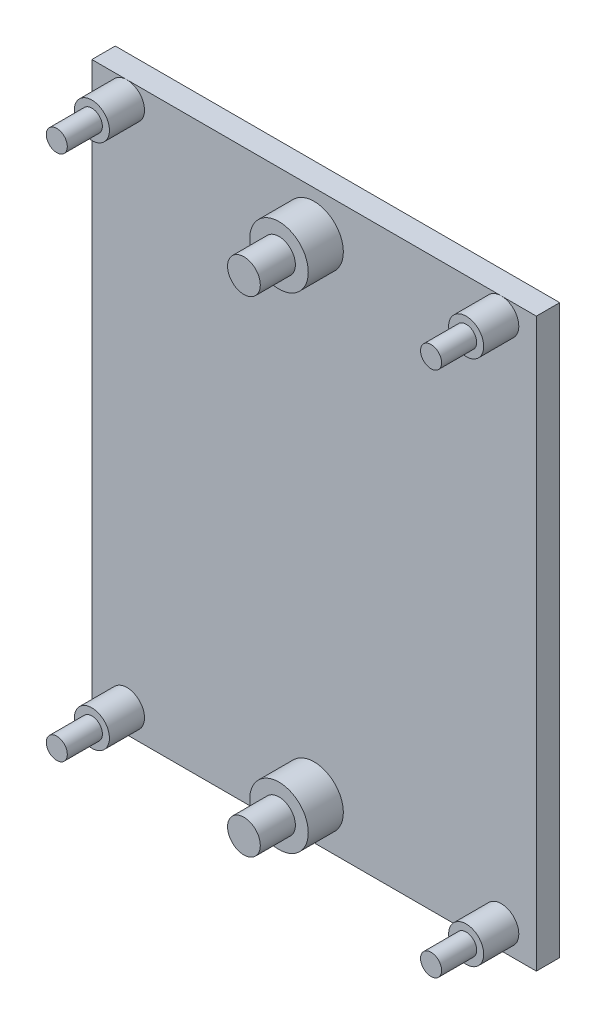
from build123d import *

# Parameters (mm, degrees)
SKIZZE1_W                       = 48.5
SKIZZE1_H                       = 38
AUFSATZ_LINEAR_AUSTRAGEN1_DEPTH = 2
SKIZZE2_R                       = 1.5
SKIZZE2_R_2                     = 2.5
AUFSATZ_LINEAR_AUSTRAGEN2_DEPTH = 3
SKIZZE3_R                       = 1.4
SKIZZE3_R_2                     = 0.9
AUFSATZ_LINEAR_AUSTRAGEN3_DEPTH = 3


with BuildPart() as part:
    # Skizze1 → Aufsatz-Linear austragen1 (new body)
    with BuildSketch(Plane(origin=(0, 0, 0), x_dir=(0, 1, 0), z_dir=(0, 0, 1))):
        Rectangle(SKIZZE1_W, SKIZZE1_H)
    extrude(amount=AUFSATZ_LINEAR_AUSTRAGEN1_DEPTH)

    # Skizze2 → Aufsatz-Linear austragen2 (add)
    with BuildSketch(Plane.XY.offset(2)):
        with Locations((-16, -22.25)):
            Circle(SKIZZE2_R)
        with Locations((16, -22.25)):
            Circle(SKIZZE2_R)
        with Locations(Location((16, 22.75, 0), (0, 0, 90))):
            Circle(SKIZZE2_R)
        with Locations(Location((-16, 22.75, 0), (0, 0, 90))):
            Circle(SKIZZE2_R)
        with Locations((0, 20.75)):
            Circle(SKIZZE2_R_2)
        with Locations((0, -20.75)):
            Circle(SKIZZE2_R_2)
    extrude(amount=AUFSATZ_LINEAR_AUSTRAGEN2_DEPTH)

    # Skizze3 → Aufsatz-Linear austragen3 (add)
    with BuildSketch(Plane.XY.offset(5)):
        with Locations((0, 20.75)):
            Circle(SKIZZE3_R)
        with Locations((16, 22.75)):
            Circle(SKIZZE3_R_2)
        with Locations((-16, 22.75)):
            Circle(SKIZZE3_R_2)
        with Locations((0, -20.75)):
            Circle(SKIZZE3_R)
        with Locations((-16, -22.25)):
            Circle(SKIZZE3_R_2)
        with Locations((16, -22.25)):
            Circle(SKIZZE3_R_2)
    extrude(amount=AUFSATZ_LINEAR_AUSTRAGEN3_DEPTH)


solid = part.part
